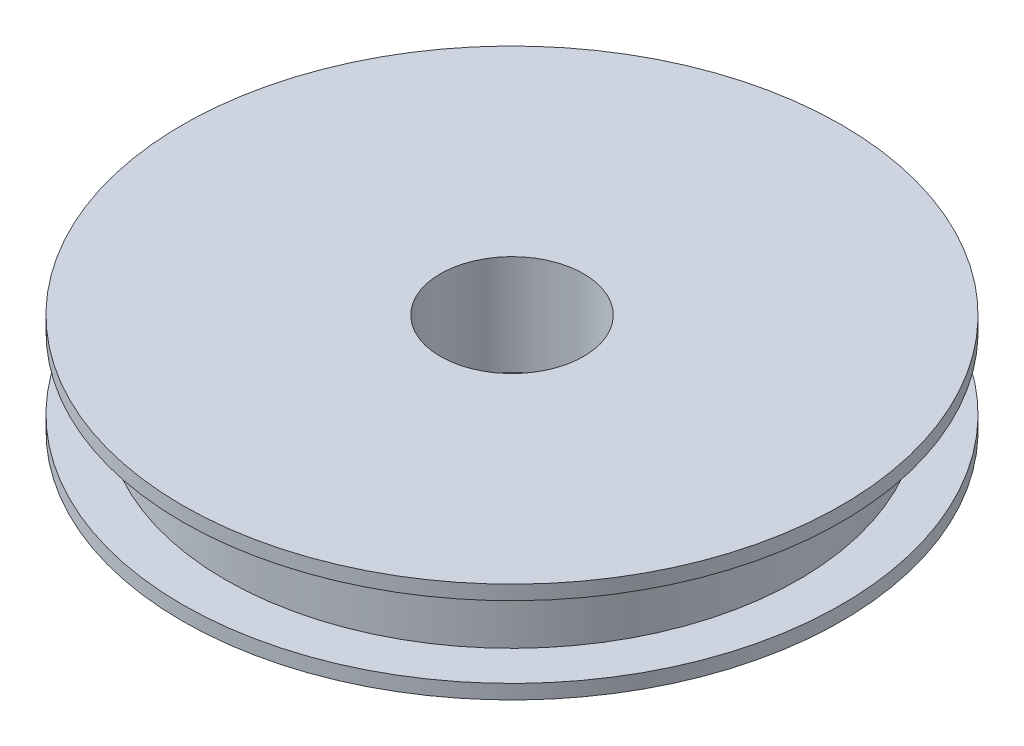
from build123d import *

# Parameters (mm, degrees)
SKETCH1_R           = 20
SKETCH1_R_2         = 5
BOSS_EXTRUDE1_DEPTH = 5
BOSS_EXTRUDE2_START = -1
SKETCH1_3_R         = 23
SKETCH1_3_R_2       = 20
SKETCH1_3_R_3       = 5
BOSS_EXTRUDE2_DEPTH = 1
BOSS_EXTRUDE3_START = 5
SKETCH1_4_R         = 23
SKETCH1_4_R_2       = 20
SKETCH1_4_R_3       = 5
BOSS_EXTRUDE3_DEPTH = 1


with BuildPart() as part:
    # Sketch1 → Boss-Extrude1 (new body)
    with BuildSketch(Plane(origin=(0, 0, 0), x_dir=(1, 0, 0), z_dir=(0, 1, 0))):
        with Locations(Location((0, 0, 0), (0, 0, 270))):
            Circle(SKETCH1_R)
        with Locations(Location((0, 0, 0), (0, 0, 270))):
            Circle(SKETCH1_R_2, mode=Mode.SUBTRACT)
    extrude(amount=BOSS_EXTRUDE1_DEPTH)

    # Sketch1<3> → Boss-Extrude2 (add)
    # profile 1 of 2: a face of its own
    with BuildSketch(Plane(origin=(0, 0, 0), x_dir=(1, 0, 0), z_dir=(0, 1, 0)).offset(BOSS_EXTRUDE2_START)):
        with Locations(Location((0, 0, 0), (0, 0, 270))):
            Circle(SKETCH1_3_R)
        with Locations(Location((0, 0, 0), (0, 0, 270))):
            Circle(SKETCH1_3_R_2, mode=Mode.SUBTRACT)
    # profile 2 of 2: a face of its own
    with BuildSketch(Plane(origin=(0, 0, 0), x_dir=(1, 0, 0), z_dir=(0, 1, 0)).offset(BOSS_EXTRUDE2_START)):
        with Locations(Location((0, 0, 0), (0, 0, 270))):
            Circle(SKETCH1_3_R_2)
        with Locations(Location((0, 0, 0), (0, 0, 270))):
            Circle(SKETCH1_3_R_3, mode=Mode.SUBTRACT)
    extrude(amount=BOSS_EXTRUDE2_DEPTH)

    # Sketch1<4> → Boss-Extrude3 (add)
    # profile 1 of 2: a face of its own
    with BuildSketch(Plane(origin=(0, 0, 0), x_dir=(1, 0, 0), z_dir=(0, 1, 0)).offset(BOSS_EXTRUDE3_START)):
        with Locations(Location((0, 0, 0), (0, 0, 270))):
            Circle(SKETCH1_4_R)
        with Locations(Location((0, 0, 0), (0, 0, 270))):
            Circle(SKETCH1_4_R_2, mode=Mode.SUBTRACT)
    # profile 2 of 2: a face of its own
    with BuildSketch(Plane(origin=(0, 0, 0), x_dir=(1, 0, 0), z_dir=(0, 1, 0)).offset(BOSS_EXTRUDE3_START)):
        with Locations(Location((0, 0, 0), (0, 0, 270))):
            Circle(SKETCH1_4_R_2)
        with Locations(Location((0, 0, 0), (0, 0, 270))):
            Circle(SKETCH1_4_R_3, mode=Mode.SUBTRACT)
    extrude(amount=BOSS_EXTRUDE3_DEPTH)


solid = part.part
